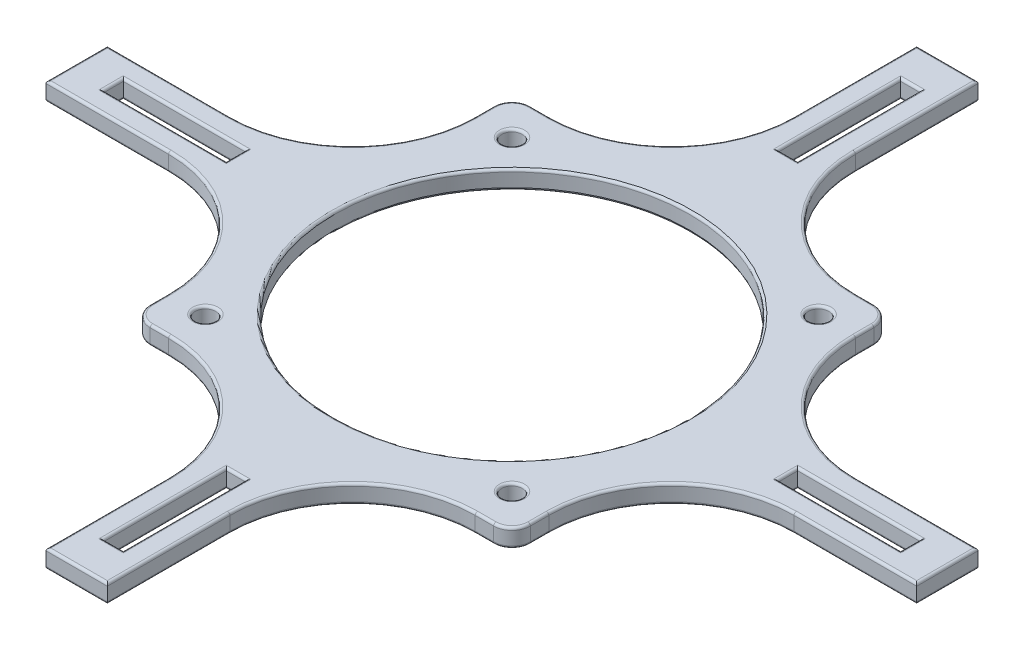
from build123d import *

# Parameters (mm, degrees)
SKETCH1_W           = 62
SKETCH1_H           = 62
BOSS_EXTRUDE1_DEPTH = 3
SKETCH2_R           = 1.65
SKETCH2_R_2         = 29
CUT_EXTRUDE1_DEPTH  = 10
SKETCH3_W           = 10
SKETCH3_H           = 40
SKETCH3_W_2         = 40
SKETCH3_H_2         = 10
BOSS_EXTRUDE2_DEPTH = 3
SKETCH4_W           = 20
SKETCH4_H           = 3.2
SKETCH4_W_2         = 3.2
SKETCH4_H_2         = 20
CUT_EXTRUDE2_DEPTH  = 10
FILLET1_R           = 20
FILLET4_R           = 3
FILLET5_R           = 0.4
FILLET7_R           = 0.4


with BuildPart() as part:
    # Sketch1 → Boss-Extrude1 (new body)
    with BuildSketch(Plane(origin=(0, 0, 0), x_dir=(1, 0, 0), z_dir=(0, 1, 0))):
        with Locations((31, -31)):
            Rectangle(SKETCH1_W, SKETCH1_H)
    extrude(amount=BOSS_EXTRUDE1_DEPTH)

    # Sketch2 → Cut-Extrude1 (cut)
    with BuildSketch(Plane(origin=(0, 0, 0), x_dir=(-1, 0, 0), z_dir=(0, -1, 0))):
        with Locations(Location((-56, -56, 0), (0, 0, 90))):
            Circle(SKETCH2_R)
        with Locations(Location((-6, -56, 0), (0, 0, 90))):
            Circle(SKETCH2_R)
        with Locations(Location((-6, -6, 0), (0, 0, 90))):
            Circle(SKETCH2_R)
        with Locations(Location((-56, -6, 0), (0, 0, 90))):
            Circle(SKETCH2_R)
        with Locations(Location((-31, -31, 0), (0, 0, 90))):
            Circle(SKETCH2_R_2)
    extrude(amount=-CUT_EXTRUDE1_DEPTH, mode=Mode.SUBTRACT)

    # Sketch3 → Boss-Extrude2 (add)
    with BuildSketch(Plane(origin=(0, 3, 0), x_dir=(1, 0, 0), z_dir=(0, 1, 0))):
        with Locations((31, 20)):
            Rectangle(SKETCH3_W, SKETCH3_H)
        with Locations((-20, -31)):
            Rectangle(SKETCH3_W_2, SKETCH3_H_2)
        with Locations((82, -31)):
            Rectangle(SKETCH3_W_2, SKETCH3_H_2)
        with Locations((31, -82)):
            Rectangle(SKETCH3_W, SKETCH3_H)
    extrude(amount=-BOSS_EXTRUDE2_DEPTH)

    # Sketch4 → Cut-Extrude2 (cut)
    with BuildSketch(Plane(origin=(0, 3, 0), x_dir=(1, 0, 0), z_dir=(0, 1, 0))):
        with Locations((86, -31)):
            Rectangle(SKETCH4_W, SKETCH4_H)
        with Locations((31, 24)):
            Rectangle(SKETCH4_W_2, SKETCH4_H_2)
        with Locations((-24, -31)):
            Rectangle(SKETCH4_W, SKETCH4_H)
        with Locations((31, -86)):
            Rectangle(SKETCH4_W_2, SKETCH4_H_2)
    extrude(amount=-CUT_EXTRUDE2_DEPTH, mode=Mode.SUBTRACT)

    # Fillet1
    fillet1_edges = [part.edges().sort_by_distance(p)[0] for p in [
        (26, 1.5, 0),
        (36, 1.5, 0),
        (0, 1.5, 26),
        (0, 1.5, 36),
        (62, 1.5, 36),
        (62, 1.5, 26),
        (26, 1.5, 62),
        (36, 1.5, 62),
    ]]
    fillet(fillet1_edges, radius=FILLET1_R)

    # Fillet4
    fillet4_edges = [part.edges().sort_by_distance(p)[0] for p in [
        (0, 1.5, 0),
        (62, 1.5, 0),
        (62, 1.5, 62),
        (0, 1.5, 62),
    ]]
    fillet(fillet4_edges, radius=FILLET4_R)

    # Fillet5
    fillet5_edges = [part.edges().sort_by_distance(p)[0] for p in [
        (76, 3, 31),
        (86, 3, 32.6),
        (96, 3, 31),
        (86, 3, 29.4),
        (29.4, 3, -24),
        (31, 3, -14),
        (32.6, 3, -24),
        (31, 3, -34),
        (-24, 3, 32.6),
        (-14, 3, 31),
        (-24, 3, 29.4),
        (-34, 3, 31),
        (32.6, 3, 86),
        (31, 3, 76),
        (29.4, 3, 86),
        (31, 3, 96),
        (36, 3, -30),
        (4.5, 3, 0),
        (-30, 3, 26),
        (0, 3, 57.5),
        (26, 3, 92),
        (57.5, 3, 62),
        (62, 3, 4.5),
        (92, 3, 36),
        (41.857864376, 3, -5.857864376),
        (20.142135624, 3, -5.857864376),
        (-5.857864376, 3, 20.142135624),
        (-5.857864376, 3, 41.857864376),
        (20.142135624, 3, 67.857864376),
        (41.857864376, 3, 67.857864376),
        (6, 3, 57.65),
        (67.857864376, 3, 20.142135624),
        (67.857864376, 3, 41.857864376),
        (6, 3, 7.65),
        (57.5, 3, 0),
        (0, 3, 4.5),
        (4.5, 3, 62),
        (62, 3, 57.5),
        (0.878679656, 3, 0.878679656),
        (0.878679656, 3, 61.121320344),
        (61.121320344, 3, 61.121320344),
        (61.121320344, 3, 0.878679656),
        (31, 3, 60),
        (56, 3, 7.65),
        (56, 3, 57.65),
        (26, 3, -30),
        (31, 3, -40),
        (-40, 3, 31),
        (-30, 3, 36),
        (102, 3, 31),
        (92, 3, 26),
        (31, 3, 102),
        (36, 3, 92),
    ]]
    fillet(fillet5_edges, radius=FILLET5_R)

    # Fillet7
    fillet7_edges = [part.edges().sort_by_distance(p)[0] for p in [
        (36, 0, -30),
        (4.5, 0, 0),
        (-30, 0, 26),
        (0, 0, 57.5),
        (26, 0, 92),
        (57.5, 0, 62),
        (62, 0, 4.5),
        (92, 0, 36),
        (41.857864376, 0, -5.857864376),
        (20.142135624, 0, -5.857864376),
        (-5.857864376, 0, 20.142135624),
        (-5.857864376, 0, 41.857864376),
        (20.142135624, 0, 67.857864376),
        (41.857864376, 0, 67.857864376),
        (6, 0, 57.65),
        (67.857864376, 0, 20.142135624),
        (67.857864376, 0, 41.857864376),
        (6, 0, 7.65),
        (57.5, 0, 0),
        (0, 0, 4.5),
        (62, 0, 57.5),
        (4.5, 0, 62),
        (0.878679656, 0, 0.878679656),
        (0.878679656, 0, 61.121320344),
        (61.121320344, 0, 61.121320344),
        (61.121320344, 0, 0.878679656),
        (31, 0, 60),
        (56, 0, 7.65),
        (56, 0, 57.65),
        (26, 0, -30),
        (31, 0, -40),
        (-30, 0, 36),
        (-40, 0, 31),
        (92, 0, 26),
        (102, 0, 31),
        (36, 0, 92),
        (31, 0, 102),
        (31, 0, 76),
        (29.4, 0, 86),
        (31, 0, 96),
        (32.6, 0, 86),
        (-14, 0, 31),
        (-24, 0, 29.4),
        (-34, 0, 31),
        (-24, 0, 32.6),
        (31, 0, -14),
        (32.6, 0, -24),
        (31, 0, -34),
        (29.4, 0, -24),
        (86, 0, 32.6),
        (96, 0, 31),
        (86, 0, 29.4),
        (76, 0, 31),
    ]]
    fillet(fillet7_edges, radius=FILLET7_R)


solid = part.part
